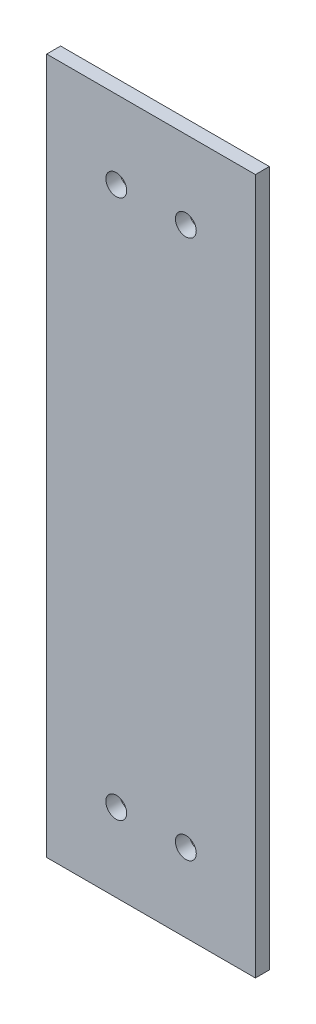
from build123d import *

# Parameters (mm, degrees)
SKETCH_1_W      = 30
SKETCH_1_H      = 100
SKETCH_1_R      = 1.5
EXTRUDE_1_DEPTH = 2


with BuildPart() as part:
    # Эскиз1 → Бобышка-Вытянуть1 (new body)
    with BuildSketch(Plane.XY):
        with Locations((15, 50)):
            Rectangle(SKETCH_1_W, SKETCH_1_H)
        with Locations((10, 11.25)):
            Circle(SKETCH_1_R, mode=Mode.SUBTRACT)
        with Locations((20, 11.25)):
            Circle(SKETCH_1_R, mode=Mode.SUBTRACT)
        with Locations((20, 88.75)):
            Circle(SKETCH_1_R, mode=Mode.SUBTRACT)
        with Locations((10, 88.75)):
            Circle(SKETCH_1_R, mode=Mode.SUBTRACT)
    extrude(amount=EXTRUDE_1_DEPTH)


solid = part.part
